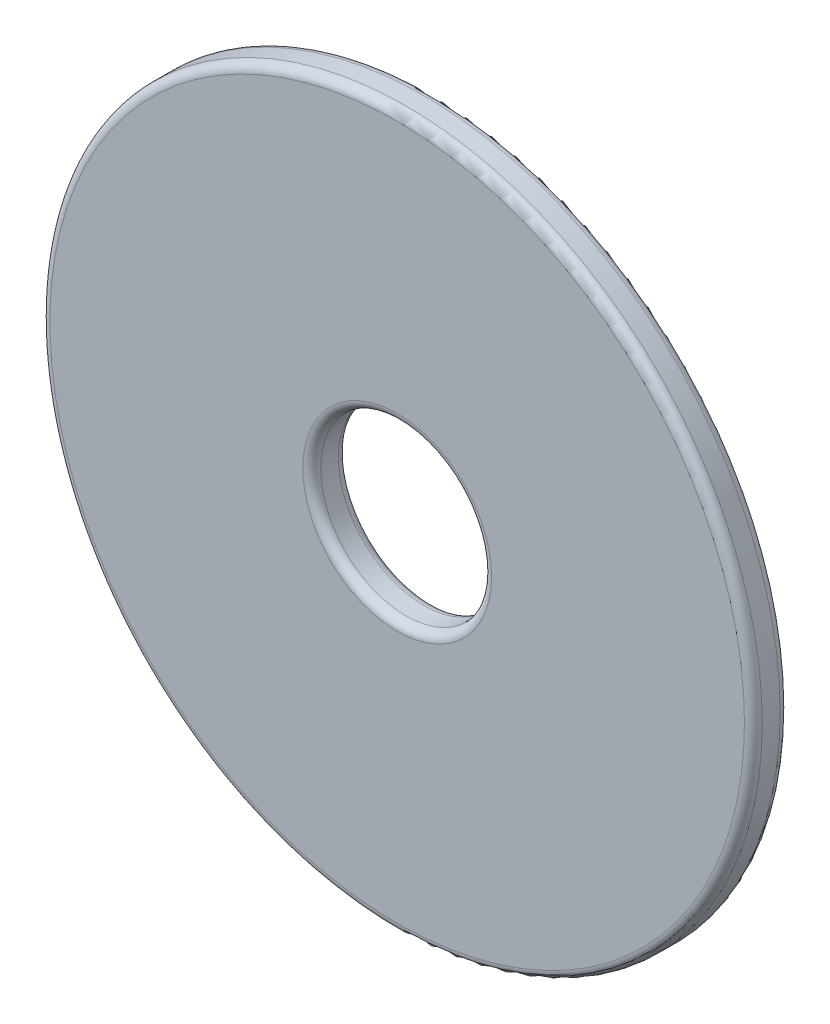
from build123d import *

# Parameters (mm, degrees)
SKETCH1_R           = 15.875
SKETCH1_R_2         = 3.81
BOSS_EXTRUDE1_DEPTH = 1.5875
FILLET1_R           = 0.396875


with BuildPart() as part:
    # Sketch1 → Boss-Extrude1 (new body)
    with BuildSketch(Plane.XY):
        Circle(SKETCH1_R)
        Circle(SKETCH1_R_2, mode=Mode.SUBTRACT)
    extrude(amount=BOSS_EXTRUDE1_DEPTH)

    # Fillet1
    fillet1_edges = [part.edges().sort_by_distance(p)[0] for p in [
        (-15.875, 0, 0),
        (-15.875, 0, 1.5875),
        (-3.81, 0, 0),
        (-3.81, 0, 1.5875),
    ]]
    fillet(fillet1_edges, radius=FILLET1_R)


solid = part.part
